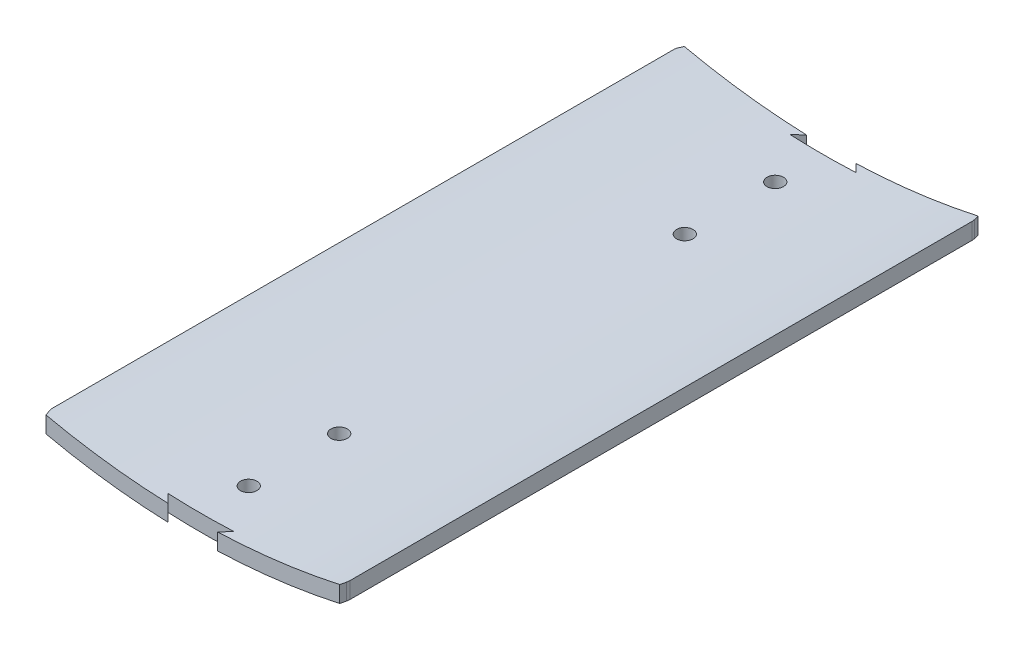
from build123d import *

# Parameters (mm, degrees)
BOSS_EXTRUDE1_DEPTH = 482.59999999999997
BOSS_EXTRUDE2_START = 98.425
BOSS_EXTRUDE2_DEPTH = 98.425
BOSS_EXTRUDE3_START = 254
BOSS_EXTRUDE3_DEPTH = 254
BOSS_EXTRUDE4_DEPTH = 254
BOSS_EXTRUDE5_DEPTH = 98.425
CUT_EXTRUDE1_DEPTH  = 98.425
SKETCH8_R           = 2.5399999999999943
SKETCH8_R_2         = 2.539999999999985
SKETCH8_R_3         = 2.5399999999999983
SKETCH8_R_4         = 2.539999999999981
SKETCH8_R_5         = 2.539999999999982
SKETCH8_R_6         = 2.539999999999969
CUT_EXTRUDE2_DEPTH  = 30.480000000000004
FILLET2_R           = 2.54
FILLET1_R           = 7.62
SKETCH9_R           = 6.349999999999994
SKETCH9_R_2         = 6.35000000000001
CUT_EXTRUDE3_DEPTH  = 38.1
CUT_EXTRUDE4_DEPTH  = 38.1


with BuildPart() as part:
    # Sketch1 → Boss-Extrude1 (new body)
    with BuildSketch(Plane.XY):
        with BuildLine():
            ThreePointArc((230.18750000000014, -12.7), (115.09375000000016, -25.399999708217024), (1.3303e-13, -12.7))
            Line((1.3303e-13, -12.7), (0, 0))
            ThreePointArc((0, 0), (115.09375000000003, -12.699999708216978), (230.1875, 0))
            Line((230.1875, 0), (230.18750000000014, -12.7))
        make_face()
    extrude(amount=BOSS_EXTRUDE1_DEPTH)

    # Sketch2 → Boss-Extrude2 (add)
    with BuildSketch(Plane(origin=(0, 0, 0), x_dir=(-1, 0, 0), z_dir=(0, 0, -1)).offset(BOSS_EXTRUDE2_START)):
        with BuildLine():
            ThreePointArc((-169.86250000000015, -9.851059053133781), (-200.16770645953937, -5.799422082207116), (-230.1875, 0))
            Line((-230.1875, 0), (-230.18750000000014, -12.7))
            ThreePointArc((-230.18750000000014, -12.700000000000045), (-200.16770645953937, -18.499422082206934), (-169.86250000000013, -22.551059053133486))
            Line((-169.86250000000015, -22.551059053133592), (-169.86250000000015, -19.049999708216802))
            Line((-169.86250000000015, -19.049999708216802), (-169.86250000000015, -9.85105905313366))
        make_face()
        with BuildLine():
            ThreePointArc((0, 0), (-30.01979354046084, -5.799422082207116), (-60.32500000000019, -9.851059053133781))
            Line((-60.325000000000166, -9.85105905313366), (-60.325000000000166, -19.049999708216802))
            Line((-60.325000000000166, -19.049999708216802), (-60.325000000000166, -22.551059053133592))
            ThreePointArc((-60.32500000000017, -22.551059053133486), (-30.01979354046088, -18.499422082207047), (-5.684e-14, -12.700000000000045))
            Line((-1.3303e-13, -12.7), (0, 0))
        make_face()
    extrude(amount=-BOSS_EXTRUDE2_DEPTH)

    # Sketch3 → Boss-Extrude3 (add)
    with BuildSketch(Plane(origin=(0, 0, 0), x_dir=(-1, 0, 0), z_dir=(0, 0, -1)).offset(BOSS_EXTRUDE3_START)):
        with BuildLine():
            Line((-169.86250000000015, -9.85105905313377), (-169.86250000000015, -22.551059053133816))
            ThreePointArc((-169.86250000000015, -22.551059053133816), (-115.0937500000001, -25.399999708217024), (-60.325000000000166, -22.551059053133816))
            Line((-60.325000000000166, -22.551059053133816), (-60.325000000000166, -9.85105905313377))
            ThreePointArc((-60.325000000000166, -9.85105905313377), (-115.0937500000002, -12.699999708216978), (-169.86250000000015, -9.85105905313377))
        make_face()
    extrude(amount=-BOSS_EXTRUDE3_DEPTH)

    # Sketch4 → Boss-Extrude4 (add)
    with BuildSketch(Plane.XY.offset(482.59999999999997)):
        with BuildLine():
            ThreePointArc((169.8625, -9.851059053133667), (115.09375, -12.699999708216865), (60.32500000000002, -9.851059053133554))
            Line((60.324999999999974, -9.85105905313366), (60.32499999999996, -22.551059053133816))
            ThreePointArc((60.32499999999997, -22.55105905313377), (115.09375, -25.399999708216967), (169.86250000000004, -22.551059053133883))
            Line((169.86249999999998, -22.551059053133816), (169.86249999999998, -9.85105905313377))
        make_face()
    extrude(amount=BOSS_EXTRUDE4_DEPTH)

    # Sketch5 → Boss-Extrude5 (add)
    with BuildSketch(Plane.XY.offset(482.59999999999997)):
        with BuildLine():
            Line((0, 0), (1.3303e-13, -12.7))
            ThreePointArc((1.3303e-13, -12.7), (115.09375000000016, -25.399999708216967), (230.18750000000014, -12.7))
            Line((230.18750000000014, -12.7), (230.1875, 0))
            ThreePointArc((230.1875, 0), (115.09375000000003, -12.699999708216865), (0, 0))
        make_face()
    extrude(amount=BOSS_EXTRUDE5_DEPTH)

    # Sketch6 → Cut-Extrude1 (cut)
    with BuildSketch(Plane(origin=(0, 0, 0), x_dir=(-1, 0, 0), z_dir=(0, -1, 0))):
        with BuildLine():
            Line((-60.324999999999974, -736.5999999999999), (-60.32499999999997, -682.625))
            ThreePointArc((-60.32499999999994, -682.625), (-73.2102757559419, -717.915091552868), (-105.80314444586806, -736.6000000000001))
            Line((-105.80314444586807, -736.5999999999999), (-60.324999999999974, -736.5999999999999))
        make_face()
        with BuildLine():
            Line((-169.86249999999998, -736.5999999999999), (-124.38435555413189, -736.5999999999999))
            ThreePointArc((-124.3843555541319, -736.6000000000001), (-156.97722424405805, -717.915091552868), (-169.8625, -682.625))
            Line((-169.86249999999998, -682.625), (-169.86249999999998, -736.5999999999999))
        make_face()
        with BuildLine():
            add(Edge.make_bspline(
                [(-169.86249999999998, -581.025), (-175.13876451622016, -517.0259135470571), (-212.83209325396822, -510.9167162698411)],
                knots=[0, 0, 0, 0.8257211002132265, 0.8257211002132265, 0.8257211002132265], degree=2))
            add(Edge.make_bspline(
                [(-212.83209325396822, -510.9167162698411), (-221.5097966268928, -510.9167162698411), (-230.18749999999994, -482.5999999999999)],
                knots=[0, 0, 0, 1, 1, 1], degree=2))
            Line((-230.18749999999994, -482.5999999999999), (-230.18750000000043, -510.9167162698411))
            Line((-230.18750000000043, -510.9167162698411), (-230.1875, -581.025))
            Line((-230.1875, -581.025), (-169.86249999999998, -581.025))
        make_face()
        with BuildLine():
            add(Edge.make_bspline(
                [(-17.35540674603169, -510.9167162698411), (-8.677703373107125, -510.9167162698411), (1.398e-14, -482.5999999999999)],
                knots=[0, 0, 0, 1, 1, 1], degree=2))
            Line((1.398e-14, -482.5999999999999), (1.195e-14, -510.9167162698411))
            Line((1.195e-14, -510.9167162698411), (0, -581.025))
            Line((0, -581.025), (-60.32499999999996, -581.025))
            add(Edge.make_bspline(
                [(-60.32499999999996, -581.025), (-55.048735482398115, -517.0259135470335), (-17.35540674603169, -510.9167162698411)],
                knots=[0, 0, 0, 0.825721100213823, 0.825721100213823, 0.825721100213823], degree=2))
        make_face()
        with BuildLine():
            add(Edge.make_bspline(
                [(-60.32500000000019, 98.42499999999998), (-55.04873548239812, 34.42591354703347), (-17.355406746031782, 28.316716269841223)],
                knots=[0, 0, 0, 0.8257211002138217, 0.8257211002138217, 0.8257211002138217], degree=2))
            add(Edge.make_bspline(
                [(-17.355406746031782, 28.316716269841223), (-8.677703373107148, 28.316716269841248), (0, 0)],
                knots=[0, 0, 0, 1, 1, 1], degree=2))
            Line((0, 0), (9.714e-14, 98.425))
            Line((9.714e-14, 98.425), (-60.32500000000019, 98.42499999999998))
        make_face()
        with BuildLine():
            add(Edge.make_bspline(
                [(-212.83209325396822, 28.31671626984129), (-221.5097966268928, 28.316716269841248), (-230.18749999999994, 0)],
                knots=[0, 0, 0, 1, 1, 1], degree=2))
            Line((-230.18749999999994, 0), (-230.1875, 98.425))
            Line((-230.1875, 98.425), (-169.86250000000015, 98.425))
            add(Edge.make_bspline(
                [(-169.86250000000015, 98.425), (-175.1387645162212, 34.4259135470572), (-212.83209325396822, 28.31671626984129)],
                knots=[0, 0, 0, 0.8257211002132272, 0.8257211002132272, 0.8257211002132272], degree=2))
        make_face()
        with BuildLine():
            Line((-169.86250000000015, 254), (-169.86250000000015, 200.02499999999998))
            ThreePointArc((-169.86250000000015, 200.02499999999998), (-156.9772242440584, 235.315091552868), (-124.38435555413241, 254.00000000000023))
            Line((-124.3843555541324, 254), (-169.86250000000015, 254))
        make_face()
        with BuildLine():
            Line((-60.32500000000019, 254), (-105.80314444586791, 254))
            ThreePointArc((-105.8031444458679, 254.0000000000002), (-73.21027575594192, 235.315091552868), (-60.32500000000019, 200.02499999999998))
            Line((-60.32500000000019, 200.02499999999998), (-60.32500000000019, 254))
        make_face()
    extrude(amount=CUT_EXTRUDE1_DEPTH, mode=Mode.SUBTRACT)

    # Sketch8 → Cut-Extrude2 (cut)
    with BuildSketch(Plane(origin=(0, 0, 0), x_dir=(-1, 0, 0), z_dir=(0, -1, 0))):
        with BuildLine():
            ThreePointArc((-100.86975371724569, 109.85500081941541), (-115.09375000000001, 98.42499999999991), (-129.31774628275423, 109.8550008194154))
            Line((-129.31774628275423, 109.8550008194154), (-129.31774628275423, 121.28499999999998))
            Line((-129.31774628275423, 121.28499999999998), (-140.7477462827542, 128.90499999999997))
            Line((-140.7477462827542, 128.90499999999997), (-140.7477462827542, 156.337))
            Line((-140.7477462827542, 156.337), (-129.31774628275423, 163.95699999999997))
            Line((-129.31774628275423, 163.95699999999997), (-129.31774628275423, 189.86500081941537))
            ThreePointArc((-129.31774628275423, 189.86500081941537), (-115.09375000000001, 201.29499584735922), (-100.86975371724574, 189.86500081941537))
            Line((-100.86975371724574, 189.86500081941537), (-100.86975371724574, 163.95699999999994))
            Line((-100.86975371724574, 163.95699999999994), (-89.43975371724572, 156.33699999999996))
            Line((-89.43975371724572, 156.33699999999996), (-89.43975371724572, 128.90499999999997))
            Line((-89.43975371724572, 128.90499999999997), (-100.8697537172457, 121.28499999999998))
            Line((-100.8697537172457, 121.28499999999998), (-100.86975371724569, 109.85500081941541))
        make_face()
        with Locations(Location((-94.13875000000002, 114.93499999999999, 0), (0, 0, 270))):
            Circle(SKETCH8_R)
        with BuildLine():
            ThreePointArc((-100.86975371724569, -672.4650008194153), (-115.09374999999996, -683.8949958473592), (-129.31774628275411, -672.4650008194153))
            Line((-129.31774628275411, -672.4650008194153), (-129.31774628275411, -646.5569999999998))
            Line((-129.31774628275411, -646.5569999999998), (-140.7477462827541, -638.9369999999999))
            Line((-140.7477462827541, -638.9369999999999), (-140.7477462827541, -611.5049999999999))
            Line((-140.7477462827541, -611.5049999999999), (-129.31774628275411, -603.8849999999999))
            Line((-129.31774628275411, -603.8849999999999), (-129.31774628275411, -592.4550008194154))
            ThreePointArc((-129.31774628275411, -592.4550008194154), (-115.09374999999994, -581.0249999999999), (-100.86975371724563, -592.4550008194154))
            Line((-100.86975371724563, -592.4550008194154), (-100.86975371724564, -603.8849999999999))
            Line((-100.86975371724564, -603.8849999999999), (-89.43975371724567, -611.5049999999999))
            Line((-89.43975371724567, -611.5049999999999), (-89.43975371724567, -638.9369999999999))
            Line((-89.43975371724567, -638.9369999999999), (-100.86975371724569, -646.5569999999998))
            Line((-100.86975371724569, -646.5569999999998), (-100.86975371724569, -672.4650008194153))
        make_face()
        with Locations(Location((-136.04875, 179.70499999999998, 0), (0, 0, 270))):
            Circle(SKETCH8_R_2)
        with Locations(Location((-94.13875000000002, 179.70499999999998, 0), (0, 0, 270))):
            Circle(SKETCH8_R_3)
        with Locations(Location((-136.04875, 114.93499999999999, 0), (0, 0, 270))):
            Circle(SKETCH8_R_4)
        with Locations(Location((-94.13874999999996, -662.305, 0), (0, 0, 270))):
            Circle(SKETCH8_R_5)
        with Locations(Location((-136.0487499999999, -662.305, 0), (0, 0, 270))):
            Circle(SKETCH8_R_6)
        with Locations(Location((-94.13874999999996, -597.535, 0), (0, 0, 270))):
            Circle(SKETCH8_R_5)
        with Locations(Location((-136.0487499999999, -597.535, 0), (0, 0, 270))):
            Circle(SKETCH8_R_6)
    extrude(amount=CUT_EXTRUDE2_DEPTH, mode=Mode.SUBTRACT)

    # Fillet2
    fillet2_edges = [part.edges().sort_by_distance(p)[0] for p in [
        (100.8697537172457, -18.858324334332178, -121.28499999999998),
        (89.43975371724572, -18.426249184171922, -128.90499999999997),
        (89.43975371724572, -18.426249184171922, -156.33699999999996),
        (100.86975371724574, -18.85832433433218, -163.95699999999994),
        (129.31774628275423, -18.858324334332185, -121.28499999999998),
        (140.7477462827542, -18.426249184171933, -128.90499999999997),
        (140.7477462827542, -18.426249184171933, -156.337),
        (129.31774628275423, -18.858324334332185, -163.95699999999997),
        (140.7477462827541, -18.426249184171937, 638.9369999999999),
        (140.7477462827541, -18.426249184171937, 611.5049999999999),
        (89.43975371724567, -18.426249184171922, 638.9369999999999),
        (89.43975371724567, -18.426249184171922, 611.5049999999999),
        (129.31774628275411, -18.858324334332185, 646.5569999999998),
        (129.31774628275411, -18.858324334332185, 603.8849999999999),
        (100.86975371724569, -18.858324334332178, 646.5569999999998),
        (100.86975371724564, -18.858324334332174, 603.8849999999999),
    ]]
    fillet(fillet2_edges, radius=FILLET2_R)

    # Fillet1
    fillet1_edges = [part.edges().sort_by_distance(p)[0] for p in [
        (0, -6.350000000000027, 0),
        (-1.398e-14, -6.350000000000038, 482.5999999999999),
        (230.18749999999994, -6.350000000000027, 0),
        (230.18749999999994, -6.350000000000038, 482.5999999999999),
    ]]
    fillet(fillet1_edges, radius=FILLET1_R)

    # Sketch9 → Cut-Extrude3 (cut)
    with BuildSketch(Plane(origin=(0, 0, 0), x_dir=(-1, 0, 0), z_dir=(0, -1, 0))):
        with Locations(Location((-115.0937500000001, -444.6177007658428, 0), (0, 0, 270))):
            Circle(SKETCH9_R)
        with Locations(Location((-115.09375000000011, -374.76770076584285, 0), (0, 0, 270))):
            Circle(SKETCH9_R)
        with Locations(Location((-115.09375000000004, -107.83229923415722, 0), (0, 0, 270))):
            Circle(SKETCH9_R_2)
        with Locations(Location((-115.09375, -37.982299234157246, 0), (0, 0, 270))):
            Circle(SKETCH9_R_2)
    extrude(amount=CUT_EXTRUDE3_DEPTH, mode=Mode.SUBTRACT)

    # Sketch10 → Cut-Extrude4 (cut)
    with BuildSketch(Plane(origin=(0, 0, 0), x_dir=(-1, 0, 0), z_dir=(0, -1, 0))):
        Polygon((-96.04374999997901, -487.7977007658429), (-134.143749999528, -487.7977007658429), (-228.51396941832957, -487.79770076538205), (-228.51396941832957, -743.3709138830835), (-1.6735305817691115, -743.3709138830835), (-1.6735305817691115, -487.7977007658429), align=None)
        Polygon((-228.51396941832942, 5.197700765381952), (-134.143749999539, 5.197700765381952), (-96.0437500000011, 5.197700765381952), (-1.6735305817690573, 5.19770076584275), (-1.6735305817690513, 264.7544501688941), (-228.51396941832942, 264.7544501688941), align=None)
        Polygon((-89.69374999999995, -481.44770076584285), (-140.49374999999998, -481.44770076584274), (-134.143749999528, -487.7977007653709), (-96.04374999997901, -487.7977007658429), align=None)
        Polygon((-96.0437500000011, 5.197700765381952), (-134.143749999539, 5.197700765381952), (-140.4937499999998, -1.1522992341573284), (-89.69374999999984, -1.1522992341572724), align=None)
    extrude(amount=CUT_EXTRUDE4_DEPTH, mode=Mode.SUBTRACT)


solid = part.part
